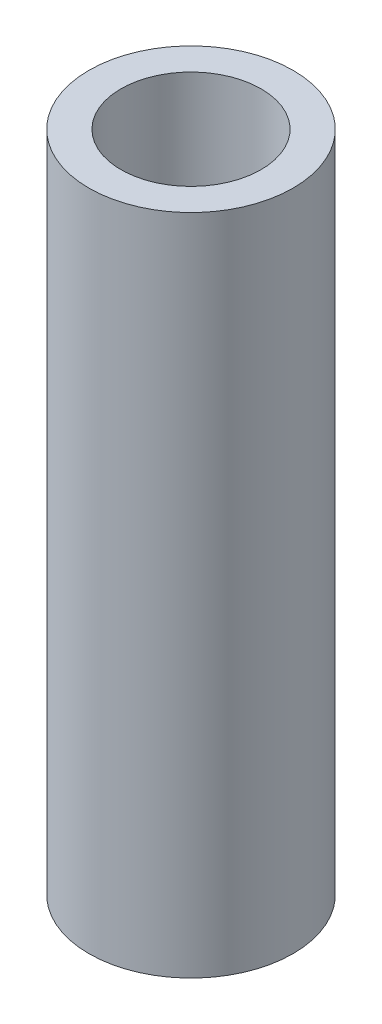
from build123d import *

# Parameters (mm, degrees)
SKETCH1_R           = 8.775
SKETCH1_R_2         = 6.025
EXTRUDE_THIN1_DEPTH = 57


with BuildPart() as part:
    # Sketch1 → Extrude-Thin1 (new body)
    with BuildSketch(Plane(origin=(0, 0, 0), x_dir=(1, 0, 0), z_dir=(0, 1, 0))):
        Circle(SKETCH1_R)
        Circle(SKETCH1_R_2, mode=Mode.SUBTRACT)
    extrude(amount=EXTRUDE_THIN1_DEPTH)


solid = part.part
